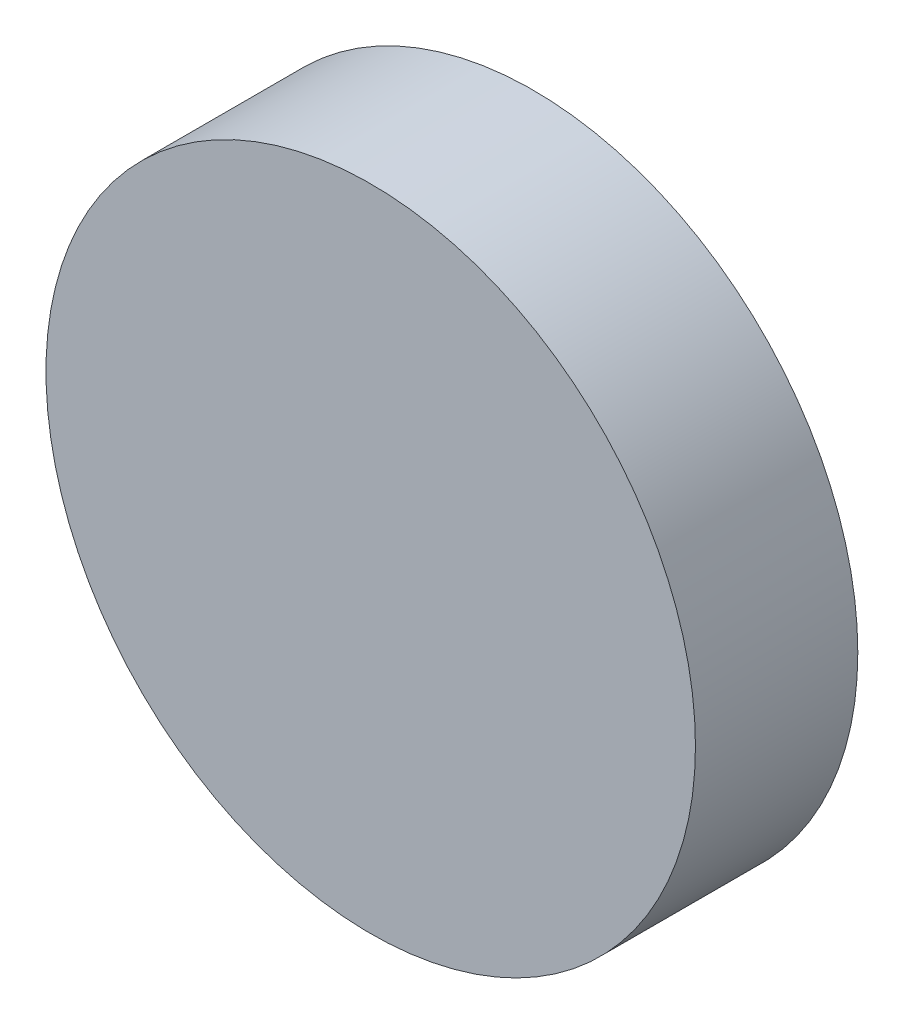
from build123d import *

# Parameters (mm, degrees)
SKETCH_3_R      = 10
EXTRUDE_1_DEPTH = 5
SKETCH_4_R      = 1
EXTRUDE_2_DEPTH = 5


with BuildPart() as part:
    # 草图3 → 凸台-拉伸1 (new body)
    with BuildSketch(Plane.XY):
        Circle(SKETCH_3_R)
    extrude(amount=EXTRUDE_1_DEPTH)

    # 草图4 → 凸台-拉伸2 (add)
    with BuildSketch(Plane(origin=(0, 0, 0), x_dir=(-1, 0, 0), z_dir=(0, 0, -1))):
        with Locations(Location((0, 0, 0), (0, 0, 180))):
            Circle(SKETCH_4_R)
    extrude(amount=EXTRUDE_2_DEPTH)


solid = part.part
